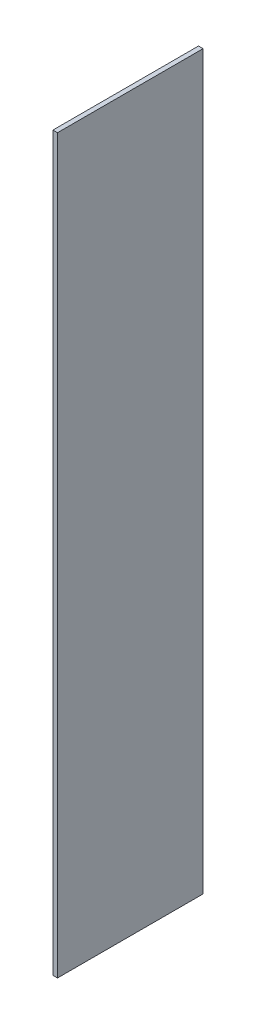
from build123d import *

# Parameters (mm, degrees)
PROFILE_SKETCH_W      = 0.55
PROFILE_SKETCH_H      = 17.5
PROFILE_EXTRUDE_DEPTH = 88


with BuildPart() as part:
    # Profile Sketch → Profile Extrude (new body)
    with BuildSketch(Plane(origin=(0.045617437, 0, -0.024209872), x_dir=(-1, 0, 0), z_dir=(0, 1, 0))):
        with Locations((0.320617437, -8.725790128)):
            Rectangle(PROFILE_SKETCH_W, PROFILE_SKETCH_H)
    extrude(amount=PROFILE_EXTRUDE_DEPTH)


solid = part.part
